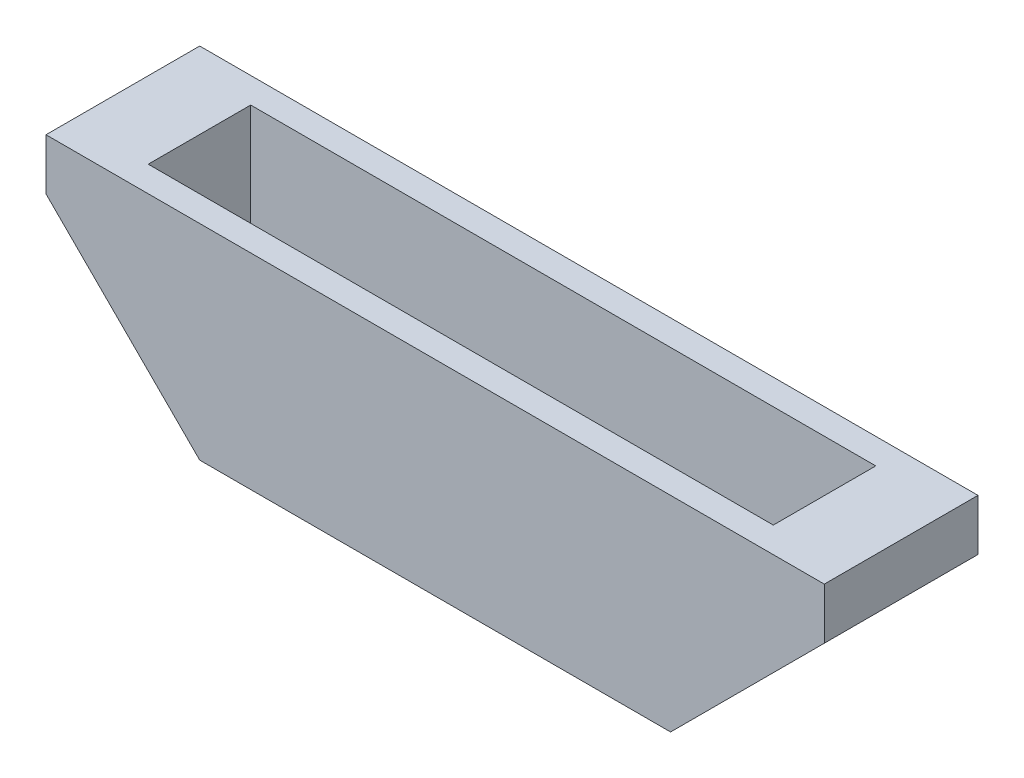
from build123d import *

# Parameters (mm, degrees)
SKETCH1_W           = 192.921126566
SKETCH1_H           = 38.1
BOSS_EXTRUDE4_DEPTH = 50.8
CHAMFER2_SIZE       = 38.1
SKETCH1_5_W         = 154.94
SKETCH1_5_H         = 25.4
CUT_EXTRUDE1_DEPTH  = 35.56


with BuildPart() as part:
    # Sketch1 → Boss-Extrude4 (new body)
    with BuildSketch(Plane(origin=(0, 0, 0), x_dir=(1, 0, 0), z_dir=(0, 1, 0))):
        Rectangle(SKETCH1_W, SKETCH1_H)
    extrude(amount=-BOSS_EXTRUDE4_DEPTH)

    # Chamfer2
    chamfer2_edges = [part.edges().sort_by_distance(p)[0] for p in [
        (96.460563283, -50.8, 0),
        (-96.460563283, -50.8, 0),
    ]]
    chamfer(chamfer2_edges, length=CHAMFER2_SIZE)

    # Sketch1<5> → Cut-Extrude1 (cut)
    with BuildSketch(Plane(origin=(0, 0, 0), x_dir=(1, 0, 0), z_dir=(0, 1, 0))):
        Rectangle(SKETCH1_5_W, SKETCH1_5_H)
    extrude(amount=-CUT_EXTRUDE1_DEPTH, mode=Mode.SUBTRACT)


solid = part.part
